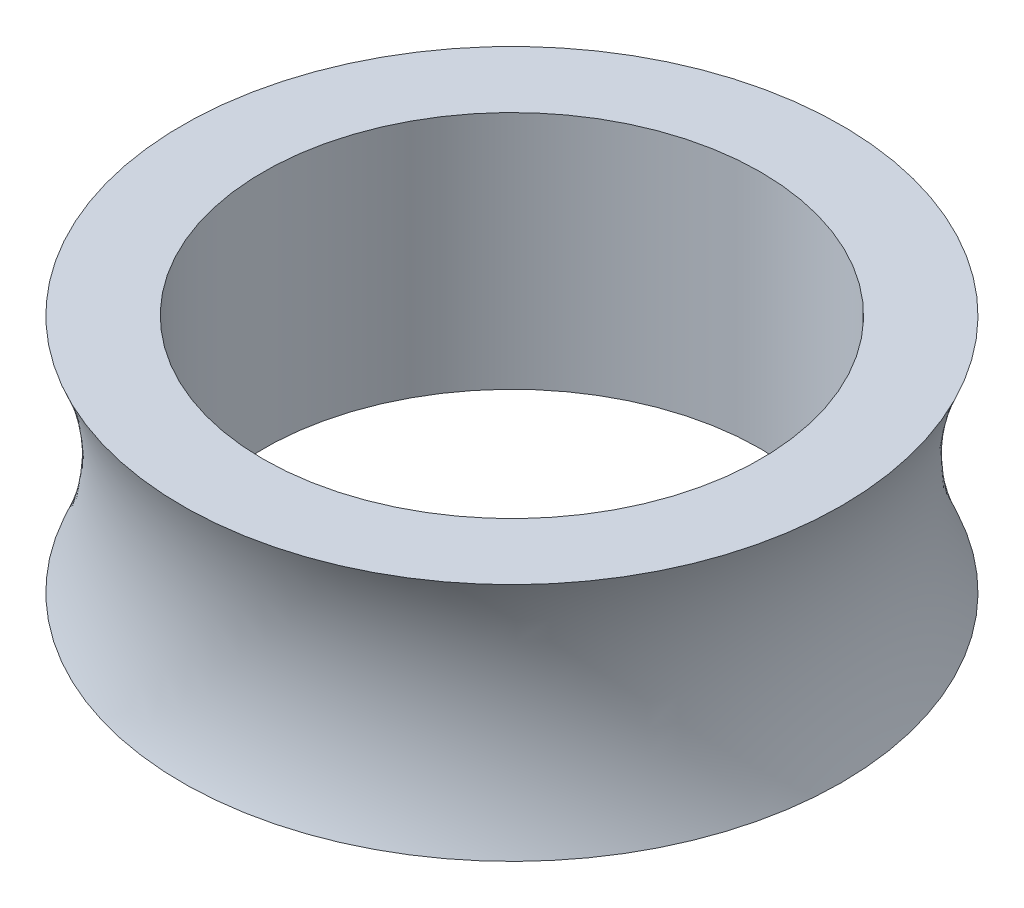
from build123d import *

# Parameters (mm, degrees)
SKETCH1_R           = 5.5
BOSS_EXTRUDE1_DEPTH = 4
SKETCH4_R           = 4.15
CUT_EXTRUDE3_DEPTH  = 9.746427842


with BuildPart() as part:
    # Sketch1 → Boss-Extrude1 (new body)
    with BuildSketch(Plane(origin=(0, 0, 0), x_dir=(1, 0, 0), z_dir=(0, 1, 0))):
        Circle(SKETCH1_R)
    extrude(amount=BOSS_EXTRUDE1_DEPTH)

    # Sketch4 → Cut-Extrude3 (cut, through all)
    with BuildSketch(Plane(origin=(0, 0, 0), x_dir=(1, 0, 0), z_dir=(0, 1, 0))):
        Circle(SKETCH4_R)
    extrude(amount=CUT_EXTRUDE3_DEPTH, mode=Mode.SUBTRACT)

    # Cut-Sweep1: sweep along a path in Sketch1<2>
    with BuildLine(Plane(origin=(0, 0, 0), x_dir=(1, 0, 0), z_dir=(0, 1, 0))) as cut_sweep1_path:
        CenterArc((0, 0), 5.5, 0, 360)
    # Sketch5 → Cut-Sweep1 (sweep, cut)
    with BuildSketch(Plane.XY):
        with BuildLine():
            Line((5.5, 4), (5.5, 0))
            ThreePointArc((5.5, 0), (5.067989981, 2), (5.5, 4))
        make_face()
    sweep(path=cut_sweep1_path.line, mode=Mode.SUBTRACT)


solid = part.part
